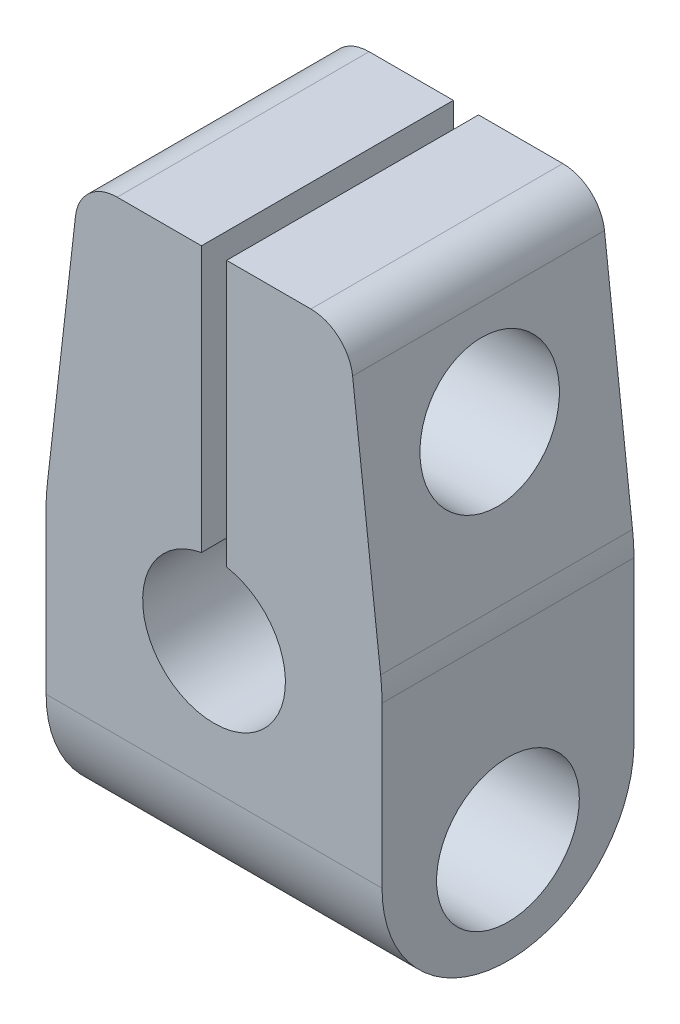
from build123d import *

# Parameters (mm, degrees)
EXTRUDE_1_DEPTH          = 6
SKETCH_2_R               = 1.7
CUT_EXTRUDE_1_DEPTH      = 13.806248475
CUT_EXTRUDE_2_DEPTH      = 11.770329614
CUT_EXTRUDE_2_DEPTH_BACK = 11.770329614
SKETCH_3_R               = 1.65
CUT_EXTRUDE_3_REACH      = 14.806


with BuildPart() as part:
    # 草图1 → 凸台-拉伸1 (new body)
    with BuildSketch(Plane.XY):
        with BuildLine():
            Line((-3.5, -7), (3.5, -7))
            ThreePointArc((3.5, -7), (3.853553391, -6.853553391), (4, -6.5))
            Line((4, -6.5), (4, 0.714692101))
            ThreePointArc((4, 0.714692101), (3.991879765, 0.999536647), (3.967545434, 1.28345599))
            Line((3.967545434, 1.28345599), (3.3, 7.113752778))
            ThreePointArc((3.3, 7.113752778), (2.972166218, 7.746241508), (2.306490913, 8))
            Line((2.306490913, 8), (0.3, 8))
            Line((0.3, 8), (0.3, 1.673320053))
            ThreePointArc((0.3, 1.673320053), (0, -1.7), (-0.3, 1.673320053))
            Line((-0.3, 1.673320053), (-0.3, 8))
            Line((-0.3, 8), (-2.306490913, 8))
            ThreePointArc((-2.306490913, 8), (-2.972166218, 7.746241508), (-3.3, 7.113752778))
            Line((-3.3, 7.113752778), (-3.967545434, 1.28345599))
            ThreePointArc((-3.967545434, 1.28345599), (-3.991879765, 0.999536647), (-4, 0.714692101))
            Line((-4, 0.714692101), (-4, -6.5))
            ThreePointArc((-4, -6.5), (-3.853553391, -6.853553391), (-3.5, -7))
        make_face()
    extrude(amount=EXTRUDE_1_DEPTH)

    # 草图2 → 切除-拉伸1 (cut, through all)
    with BuildSketch(Plane(origin=(4, 0, 0), x_dir=(0, 0, -1), z_dir=(1, 0, 0))):
        with Locations((-3, -3.6)):
            Circle(SKETCH_2_R)
    extrude(amount=-CUT_EXTRUDE_1_DEPTH, mode=Mode.SUBTRACT)

    # 草图3 → 切除-拉伸2 (cut, two sides: drawn at the far end of the back side and taken through both)
    with BuildSketch(Plane(origin=(0, 0, 0), x_dir=(0, 0, -1), z_dir=(1, 0, 0)).offset(-CUT_EXTRUDE_2_DEPTH_BACK)):
        with Locations(Location((-3, 4.8, 0), (0, 0, 90))):
            Circle(SKETCH_3_R)
    extrude(amount=CUT_EXTRUDE_2_DEPTH + CUT_EXTRUDE_2_DEPTH_BACK, mode=Mode.SUBTRACT)

    # 草图4 → 切除-拉伸3 (cut, up to next)
    with BuildSketch(Plane.ZY.offset(4), mode=Mode.PRIVATE) as cut_extrude_3_sk1:
        with BuildLine():
            Line((0, -3.172768856), (0, -9.012994764))
            Line((0, -9.012994764), (5.999117319, -9.012994764))
            Line((5.999117319, -9.012994764), (6.094166497, -9.012994764))
            Line((6.094166497, -9.012994764), (6.094166497, -3.1))
            Line((6.094166497, -3.1), (5.999117319, -3.1))
            ThreePointArc((5.999117319, -3.1), (3.035504424, -6.099779322), (0, -3.172768856))
        make_face()
    cut_extrude_3_tool1 = extrude(cut_extrude_3_sk1.sketch, amount=-CUT_EXTRUDE_3_REACH, mode=Mode.PRIVATE) & part.part
    add(cut_extrude_3_tool1.solids().sort_by_distance((-4, -7.143206, 3.078044))[0], mode=Mode.SUBTRACT)


solid = part.part
